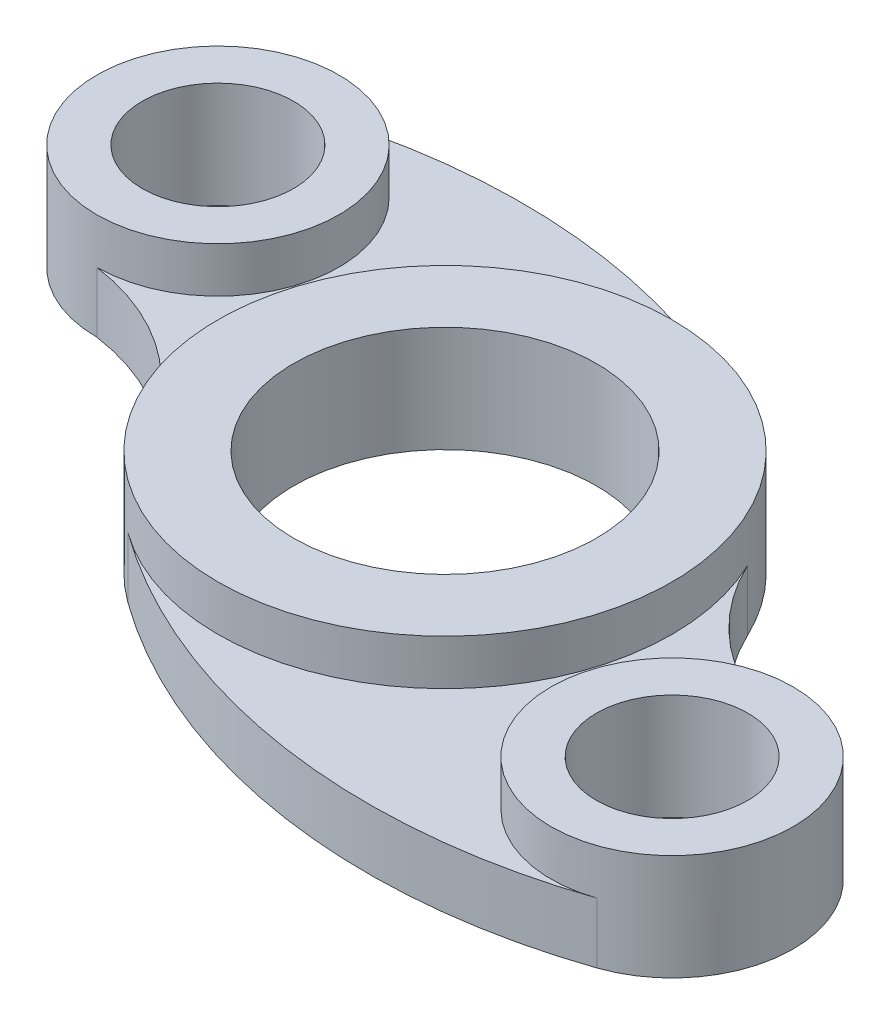
from build123d import *

# Parameters (mm, degrees)
ESTRUSIONE_ESTRUSIONE1_DEPTH   = 8
ESTRUSIONE_ESTRUSIONE1_2_DEPTH = 8
SCHIZZO1_8_R                   = 30
SCHIZZO1_8_R_2                 = 20
SCHIZZO1_8_R_3                 = 16
SCHIZZO1_8_R_4                 = 10
ESTRUSIONE_ESTRUSIONE2_DEPTH   = 14


with BuildPart() as part:
    # Schizzo1 → Estrusione-Estrusione1 (new body)
    with BuildSketch(Plane(origin=(0, 0, 0), x_dir=(1, 0, 0), z_dir=(0, 1, 0))):
        with BuildLine():
            ThreePointArc((27.108090114, 12.851126424), (19.193137928, -23.056961129), (-17.554966307, -24.327415768))
            ThreePointArc((-17.554966307, -24.327415768), (17.499627211, -38.585427044), (55.185430705, -35.136423237))
            ThreePointArc((55.185430705, -35.136423237), (34.217370755, -22.628424263), (50, -4))
            ThreePointArc((50, -4), (36.431563461, 1.542215464), (27.108090114, 12.851126424))
        make_face()
    extrude(amount=ESTRUSIONE_ESTRUSIONE1_DEPTH)



with BuildPart() as body_2:
    # Schizzo1 → Estrusione-Estrusione1 2 (new body)
    with BuildSketch(Plane(origin=(0, 0, 0), x_dir=(1, 0, 0), z_dir=(0, 1, 0))):
        with BuildLine():
            ThreePointArc((-27.108090114, -12.851126424), (-19.193137928, 23.056961129), (17.554966307, 24.327415768))
            ThreePointArc((17.554966307, 24.327415768), (-17.499627211, 38.585427044), (-55.185430705, 35.136423237))
            ThreePointArc((-55.185430705, 35.136423237), (-34.217370755, 22.628424263), (-50, 4))
            ThreePointArc((-50, 4), (-36.431563461, -1.542215464), (-27.108090114, -12.851126424))
        make_face()
    extrude(amount=ESTRUSIONE_ESTRUSIONE1_2_DEPTH)


with BuildPart() as part_1:
    add(part.part)

    add(body_2.part)  # Estrusione-Estrusione2 merges body 2
    # Schizzo1<8> → Estrusione-Estrusione2 (add)
    # profile 1 of 3: a face of its own
    with BuildSketch(Plane(origin=(0, 0, 0), x_dir=(1, 0, 0), z_dir=(0, 1, 0))):
        Circle(SCHIZZO1_8_R)
        Circle(SCHIZZO1_8_R_2, mode=Mode.SUBTRACT)
    # profile 2 of 3: a face of its own
    with BuildSketch(Plane(origin=(0, 0, 0), x_dir=(1, 0, 0), z_dir=(0, 1, 0))):
        with Locations((50, -20)):
            Circle(SCHIZZO1_8_R_3)
        with Locations((50, -20)):
            Circle(SCHIZZO1_8_R_4, mode=Mode.SUBTRACT)
    # profile 3 of 3: a face of its own
    with BuildSketch(Plane(origin=(0, 0, 0), x_dir=(1, 0, 0), z_dir=(0, 1, 0))):
        with Locations((-50, 20)):
            Circle(SCHIZZO1_8_R_3)
        with Locations((-50, 20)):
            Circle(SCHIZZO1_8_R_4, mode=Mode.SUBTRACT)
    extrude(amount=ESTRUSIONE_ESTRUSIONE2_DEPTH)


solid = part_1.part
